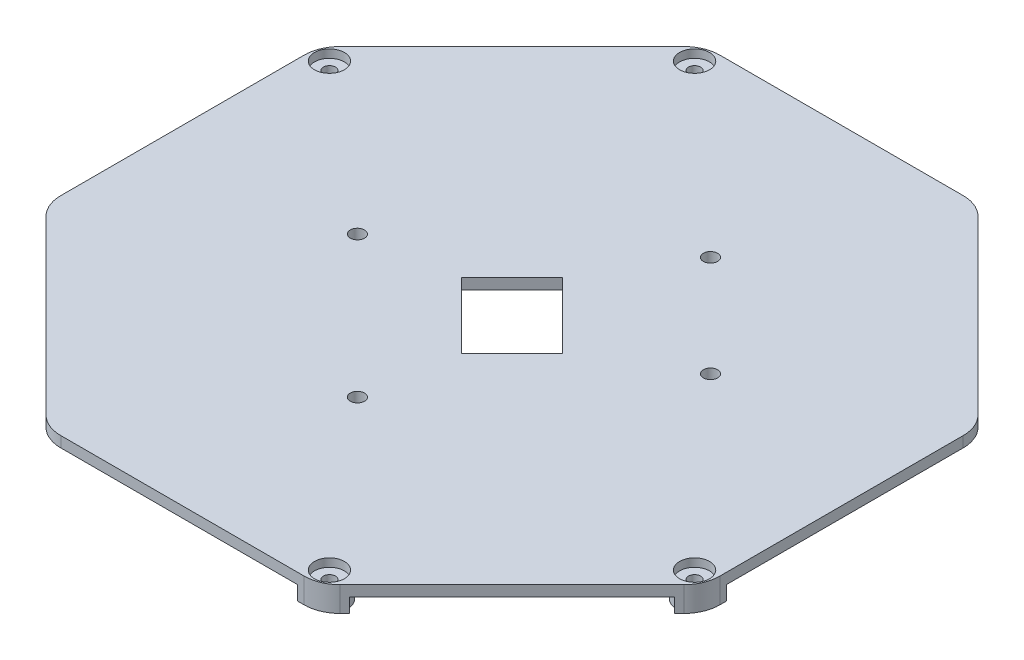
from build123d import *

# Parameters (mm, degrees)
BOSS_EXTRUDE1_DEPTH                              = 3
BOSS_EXTRUDE3_DEPTH                              = 7
CBORE_FOR_M3_HEX_HEAD_MACHINE_SCREW1_D           = 3.4
CBORE_FOR_M3_HEX_HEAD_MACHINE_SCREW1_CBORE_D     = 8.4
CBORE_FOR_M3_HEX_HEAD_MACHINE_SCREW1_CBORE_DEPTH = 2.3
FILLET1_R                                        = 10
SKETCH23_R                                       = 2
CUT_EXTRUDE1_DEPTH                               = 131.843677004
CUT_EXTRUDE2_DEPTH                               = 131.843677004


with BuildPart() as part:
    # Sketch1 → Boss-Extrude1 (new body)
    with BuildSketch(Plane(origin=(0, 0, 0), x_dir=(1, 0, 0), z_dir=(0, 1, 0))):
        Polygon((92.387953251, -38.268343237), (92.387953251, 38.268343237), (38.268343237, 92.387953251), (-38.268343237, 92.387953251), (-92.387953251, 38.268343237), (-92.387953251, -38.268343237), (-38.268343237, -92.387953251), (38.268343237, -92.387953251), align=None)
    extrude(amount=BOSS_EXTRUDE1_DEPTH)

    # Sketch13 → Boss-Extrude3 (add)
    with BuildSketch(Plane(origin=(0, 3, 0), x_dir=(1, 0, 0), z_dir=(0, 1, 0))):
        with BuildLine():
            ThreePointArc((-90.387953251, 32.197275425), (-82.768555589, 34.283858263), (-86.68084647, 41.147022893))
            Line((-86.68084647, 41.147022893), (-88.095060032, 42.561236455))
            Line((-88.095060032, 42.561236455), (-92.387953251, 38.268343237))
            Line((-92.387953251, 38.268343237), (-92.387953251, 32.197275425))
            Line((-92.387953251, 32.197275425), (-90.387953251, 32.197275425))
        make_face()
        with BuildLine():
            Line((92.387953251, -32.197275425), (90.387953251, -32.197275425))
            ThreePointArc((90.387953251, -32.197275425), (82.768555589, -34.283858263), (86.68084647, -41.147022893))
            Line((86.68084647, -41.147022893), (88.095060032, -42.561236455))
            Line((88.095060032, -42.561236455), (92.387953251, -38.268343237))
            Line((92.387953251, -38.268343237), (92.387953251, -32.197275425))
        make_face()
        with BuildLine():
            Line((38.268343237, -92.387953251), (42.561236455, -88.095060032))
            Line((42.561236455, -88.095060032), (41.147022893, -86.68084647))
            ThreePointArc((41.147022893, -86.68084647), (34.283858263, -82.768555589), (32.197275425, -90.387953251))
            Line((32.197275425, -90.387953251), (32.197275425, -92.387953251))
            Line((32.197275425, -92.387953251), (38.268343237, -92.387953251))
        make_face()
        with BuildLine():
            ThreePointArc((-41.147022893, 86.68084647), (-34.283858263, 82.768555589), (-32.197275425, 90.387953251))
            Line((-32.197275425, 90.387953251), (-32.197275425, 92.387953251))
            Line((-32.197275425, 92.387953251), (-38.268343237, 92.387953251))
            Line((-38.268343237, 92.387953251), (-42.561236455, 88.095060032))
            Line((-42.561236455, 88.095060032), (-41.147022893, 86.68084647))
        make_face()
    extrude(amount=-BOSS_EXTRUDE3_DEPTH)

    # CBORE for M3 Hex Head Machine Screw1 (through all)
    with Locations(Plane(origin=(0, 3, 0), x_dir=(1, 0, 0), z_dir=(0, 1, 0))):
        with Locations((36.197275425, -87.387953251), (87.387953251, -36.197275425), (-36.197275425, 87.387953251), (-87.387953251, 36.197275425)):
            CounterBoreHole(CBORE_FOR_M3_HEX_HEAD_MACHINE_SCREW1_D / 2, CBORE_FOR_M3_HEX_HEAD_MACHINE_SCREW1_CBORE_D / 2, CBORE_FOR_M3_HEX_HEAD_MACHINE_SCREW1_CBORE_DEPTH)

    # Fillet1
    fillet1_edges = [part.edges().sort_by_distance(p)[0] for p in [
        (-92.387953251, 1.5, 38.268343237),
        (-92.387953251, -0.5, -38.268343237),
        (-38.268343237, -0.5, -92.387953251),
        (38.268343237, 1.5, -92.387953251),
        (92.387953251, 1.5, -38.268343237),
        (92.387953251, -0.5, 38.268343237),
        (38.268343237, -0.5, 92.387953251),
        (-38.268343237, 1.5, 92.387953251),
    ]]
    fillet(fillet1_edges, radius=FILLET1_R)

    # Sketch23 → Cut-Extrude1 (cut, through all)
    with BuildSketch(Plane(origin=(0, 3, 0), x_dir=(1, 0, 0), z_dir=(0, 1, 0))):
        with Locations(Location((-41.471812717, -1.87383297, 0), (0, 0, 270))):
            Circle(SKETCH23_R)
        with Locations(Location((13.682516216, 41.966787463, 0), (0, 0, 270))):
            Circle(SKETCH23_R)
        with Locations(Location((41.966787463, 13.682516216, 0), (0, 0, 270))):
            Circle(SKETCH23_R)
        with Locations(Location((-1.87383297, -41.471812717, 0), (0, 0, 270))):
            Circle(SKETCH23_R)
    extrude(amount=-CUT_EXTRUDE1_DEPTH, mode=Mode.SUBTRACT)

    # Sketch24 → Cut-Extrude2 (cut, through all)
    with BuildSketch(Plane(origin=(0, 3, 0), x_dir=(1, 0, 0), z_dir=(0, 1, 0))):
        Polygon((-16.263455967, 2.121320344), (-2.121320344, 16.263455967), (16.263455967, -2.121320344), (2.121320344, -16.263455967), align=None)
    extrude(amount=-CUT_EXTRUDE2_DEPTH, mode=Mode.SUBTRACT)


solid = part.part
